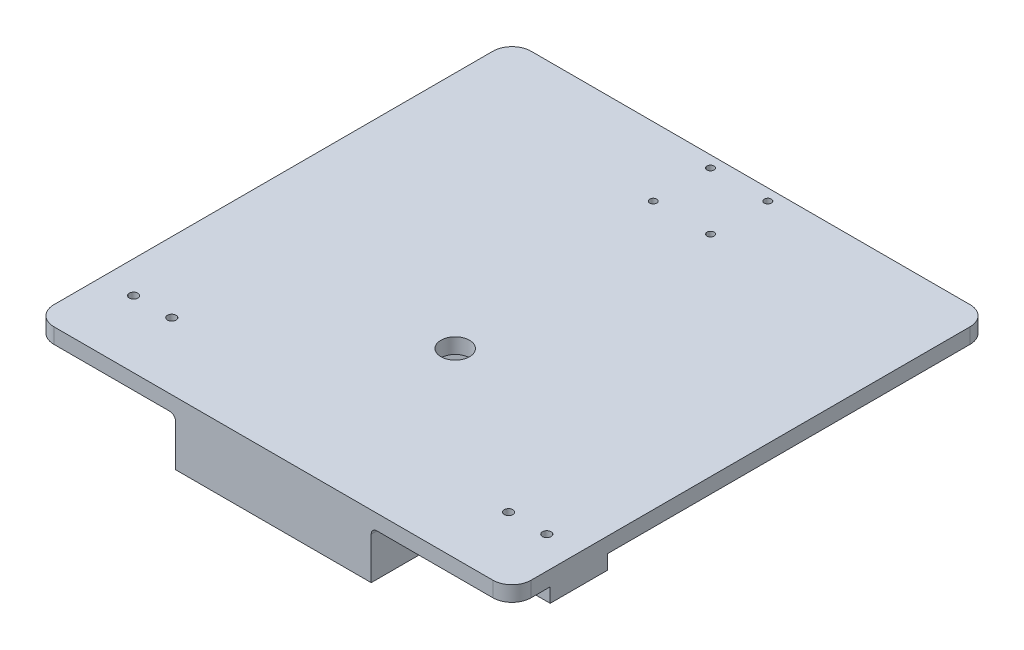
from build123d import *

# Parameters (mm, degrees)
SKETCH1_W           = 250
SKETCH1_H           = 250
BOSS_EXTRUDE1_DEPTH = 8
SKETCH2_W           = 53.55
SKETCH2_H           = 30
BOSS_EXTRUDE2_DEPTH = 7.5
SKETCH3_R           = 2.25
CUT_EXTRUDE1_DEPTH  = 178.454923854
SKETCH4_R           = 1.5
BOSS_EXTRUDE3_DEPTH = 25
FILLET1_R           = 3
CUT_EXTRUDE2_REACH  = 219.518
SKETCH5_W           = 20
SKETCH5_H           = 10
SKETCH6_R           = 1.85096309
SKETCH6_R_2         = 7.5
CUT_EXTRUDE3_DEPTH  = 20
FILLET2_R           = 10


with BuildPart() as part:
    # Sketch1 → Boss-Extrude1 (new body)
    with BuildSketch(Plane(origin=(0, 0, 0), x_dir=(1, 0, 0), z_dir=(0, 1, 0))):
        Rectangle(SKETCH1_W, SKETCH1_H)
    extrude(amount=BOSS_EXTRUDE1_DEPTH)

    # Sketch2 → Boss-Extrude2 (add)
    with BuildSketch(Plane.XZ):
        with Locations((-98.225, 90)):
            Rectangle(SKETCH2_W, SKETCH2_H)
        with Locations((98.225, 90)):
            Rectangle(SKETCH2_W, SKETCH2_H)
    extrude(amount=BOSS_EXTRUDE2_DEPTH)

    # Sketch3 → Cut-Extrude1 (cut, through all)
    with BuildSketch(Plane.XZ.offset(7.5)):
        with Locations((108.225, 90)):
            Circle(SKETCH3_R)
        with Locations((88.225, 90)):
            Circle(SKETCH3_R)
        with Locations((-108.225, 90)):
            Circle(SKETCH3_R)
        with Locations((-88.225, 90)):
            Circle(SKETCH3_R)
    extrude(amount=-CUT_EXTRUDE1_DEPTH, mode=Mode.SUBTRACT)

    # Sketch4 → Boss-Extrude3 (add)
    with BuildSketch(Plane.XZ):
        Polygon((0, 125), (-51.24999854, 125), (-51.24999854, 16.74000082), (0, 16.74000082), (51.24999854, 16.74000082), (51.24999854, 125), align=None)
        with Locations(Location((-44.24999854, 118, 0), (0, 0, 270))):
            Circle(SKETCH4_R, mode=Mode.SUBTRACT)
        with Locations(Location((44.24999854, 118, 0), (0, 0, 90))):
            Circle(SKETCH4_R, mode=Mode.SUBTRACT)
        with Locations(Location((44.24999854, 23.74000082, 0), (0, 0, 270))):
            Circle(SKETCH4_R, mode=Mode.SUBTRACT)
        with Locations(Location((-44.24999854, 23.74000082, 0), (0, 0, 90))):
            Circle(SKETCH4_R, mode=Mode.SUBTRACT)
        Polygon((0, 122), (-40.24999854, 122), (-40.24999854, 114), (-48.24999854, 114), (-48.24999854, 27.74000082), (-40.24999854, 27.74000082), (-40.24999854, 19.74000082), (0, 19.74000082), (40.24999854, 19.74000082), (40.24999854, 27.74000082), (48.24999854, 27.74000082), (48.24999854, 114), (40.24999854, 114), (40.24999854, 122), align=None, mode=Mode.SUBTRACT)
    extrude(amount=BOSS_EXTRUDE3_DEPTH)

    # Fillet1
    fillet1_edges = [part.edges().sort_by_distance(p)[0] for p in [
        (-51.24999854, 0, 70.87000041),
        (0, 0, 16.74000082),
        (-51.24999854, -12.5, 16.74000082),
        (51.24999854, 0, 70.87000041),
        (51.24999854, -12.5, 16.74000082),
    ]]
    fillet(fillet1_edges, radius=FILLET1_R)

    # Cut-Extrude2: up to this face of the body (flat: up to its plane)
    cut_extrude2_end = Plane(part.part.faces().sort_by_distance((51.24999854, -14, 72.37000041))[0])
    # Sketch5 → Cut-Extrude2 (cut, up to the picked face)
    with BuildSketch(Plane.ZY.offset(51.24999854), mode=Mode.PRIVATE) as cut_extrude2_sk1:
        with Locations((72.37000041, -8)):
            Rectangle(SKETCH5_W, SKETCH5_H)
    cut_extrude2_tool1 = split(extrude(cut_extrude2_sk1.sketch, amount=-CUT_EXTRUDE2_REACH, mode=Mode.PRIVATE), bisect_by=cut_extrude2_end, keep=Keep.BOTH, mode=Mode.PRIVATE)
    add(cut_extrude2_tool1.solids().sort_by(Axis((-51.249999, -8, 72.37), (1, 0, 0)))[0], mode=Mode.SUBTRACT)

    # Sketch6 → Cut-Extrude3 (cut)
    with BuildSketch(Plane.XZ):
        with Locations(Location((-15, -89, 0), (0, 0, 270))):
            Circle(SKETCH6_R)
        with Locations(Location((15, -89, 0), (0, 0, 270))):
            Circle(SKETCH6_R)
        with Locations(Location((15, -119, 0), (0, 0, 270))):
            Circle(SKETCH6_R)
        with Locations(Location((-15, -119, 0), (0, 0, 270))):
            Circle(SKETCH6_R)
        with Locations(Location((0, 29.74000082, 0), (0, 0, 270))):
            Circle(SKETCH6_R_2)
    extrude(amount=-CUT_EXTRUDE3_DEPTH, mode=Mode.SUBTRACT)

    # Fillet2
    fillet2_edges = [part.edges().sort_by_distance(p)[0] for p in [
        (125, 4, 125),
        (-125, 4, 125),
        (-125, 4, -125),
        (125, 4, -125),
    ]]
    fillet(fillet2_edges, radius=FILLET2_R)


solid = part.part
